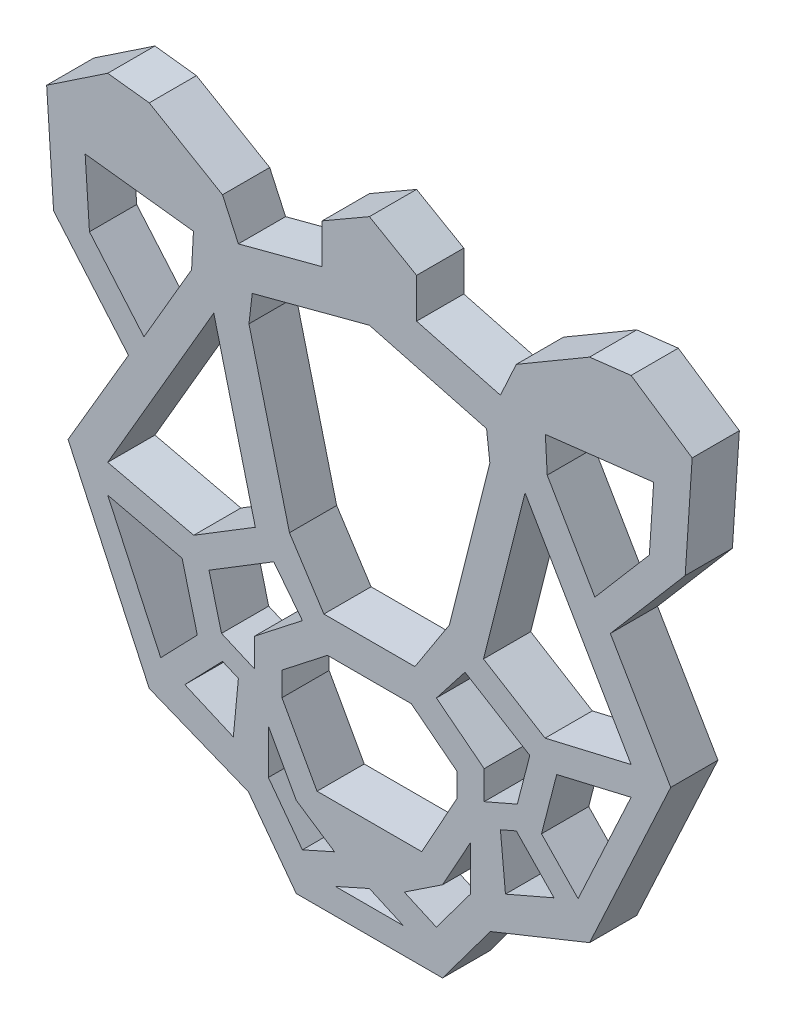
from build123d import *

# Parameters (mm, degrees)
BOSS_EXTRUDE1_DEPTH = 10
BOSS_EXTRUDE2_DEPTH = 10


with BuildPart() as part:
    # Sketch1 → Boss-Extrude1 (new body)
    with BuildSketch(Plane.XY):
        Polygon((127.703033666, 180.965914282), (99.942912825, 173.631948997), (96.578915919, 180.965914282), (81.052776354, 190.063780037), (72.254630601, 191.098856008), (59.316180963, 182.430094751), (60.790297203, 160.111634548), (76.653703478, 141.544593896), (63.855106266, 119.702899162), (81.052776354, 82.611392369), (102.070810081, 74.154129577), (112.205480651, 60.552230042), (143.200586682, 60.552230042), (153.335257251, 74.154129577), (174.353290979, 82.611392369), (191.550961067, 119.702899162), (178.752363855, 141.544593896), (194.61577013, 160.111634548), (196.089886369, 182.430094751), (183.151436732, 191.098856008), (174.353290979, 190.063780037), (158.827151414, 180.965914282), (155.463154508, 173.631948997), align=None)
        Polygon((67.474305777, 173.897244281), (68.387150649, 160.076562168), (79.931030202, 146.565234447), (90.026558446, 163.917673436), (90.423397797, 171.197351102), align=None, mode=Mode.SUBTRACT)
        Polygon((127.703033666, 172.577463554), (102.879615929, 166.019347867), (102.18046467, 160.076562168), (110.765700355, 126.038475421), (118.058737252, 114.76612201), (137.34733008, 114.76612201), (144.640366978, 126.038475421), (153.225602663, 160.076562168), (152.526451404, 166.019347867), align=None, mode=Mode.SUBTRACT)
        Polygon((136.586125745, 107.572158068), (118.819941588, 107.572158068), (109.172351708, 100.037547324), (109.172351708, 94.966141376), (116.6084589, 81.530126894), (138.797608433, 81.530126894), (146.233715625, 94.966141376), (146.233715625, 100.037547324), align=None, mode=Mode.SUBTRACT)
        Polygon((127.703033666, 69.222589269), (120.501208911, 66.003395505), (134.904858422, 66.003395505), align=None, mode=Mode.SUBTRACT)
        Polygon((106.298254857, 88.333075052), (112.205480651, 77.659537236), (120.314301927, 72.265301124), (113.507293972, 69.222589269), (106.298254857, 78.897953172), align=None, mode=Mode.SUBTRACT)
        Polygon((88.584904383, 87.077096627), (98.87165084, 82.611392369), (99.942912825, 93.893171548), (96.578915919, 95.353557042), align=None, mode=Mode.SUBTRACT)
        Polygon((88.013567695, 109.993210583), (91.237528294, 97.494221969), (83.484010106, 89.466752149), (72.254630601, 113.685998364), align=None, mode=Mode.SUBTRACT)
        Polygon((93.714725872, 110.641384033), (96.363799956, 100.371175761), (103.381612359, 97.324588109), (103.381612359, 103.375859749), (113.507293972, 111.283852358), (107.442428718, 119.04952661), align=None, mode=Mode.SUBTRACT)
        Polygon((72.254630601, 119.702899162), (94.729608094, 158.333436003), (103.533048595, 123.430227468), (90.476275499, 115.433025678), align=None, mode=Mode.SUBTRACT)
        Polygon((164.929791833, 115.433025678), (183.151436732, 119.702899162), (160.676459238, 158.333436003), (151.873018738, 123.430227468), align=None, mode=Mode.SUBTRACT)
        Polygon((147.963638615, 119.04952661), (161.691341461, 110.641384033), (159.042267377, 100.371175761), (152.024454974, 97.324588109), (152.024454974, 103.375859749), (141.898773361, 111.283852358), align=None, mode=Mode.SUBTRACT)
        Polygon((183.151436732, 113.685998364), (167.392499638, 109.993210583), (164.168539039, 97.494221969), (171.922057227, 89.466752149), align=None, mode=Mode.SUBTRACT)
        Polygon((158.827151414, 95.353557042), (166.821162949, 87.077096627), (156.534416493, 82.611392369), (155.463154508, 93.893171548), align=None, mode=Mode.SUBTRACT)
        Polygon((149.107812476, 78.897953172), (149.107812476, 88.333075052), (143.200586682, 77.659537236), (135.091765405, 72.265301124), (141.898773361, 69.222589269), align=None, mode=Mode.SUBTRACT)
        Polygon((164.982669535, 171.197351102), (187.931761556, 173.897244281), (187.018916684, 160.076562168), (175.475037131, 146.565234447), (165.379508887, 163.917673436), align=None, mode=Mode.SUBTRACT)
    extrude(amount=BOSS_EXTRUDE1_DEPTH)

    # Sketch2 → Boss-Extrude2 (add)
    with BuildSketch(Plane.XY.offset(10)):
        Polygon((137.703033666, 186.739416974), (127.703033666, 192.512919666), (117.703033666, 186.739416974), (117.703033666, 175.19241159), (123.949734855, 171.585876977), (127.703033666, 172.577463554), (131.456332478, 171.585876977), (137.703033666, 175.19241159), align=None)
    extrude(amount=-BOSS_EXTRUDE2_DEPTH)


solid = part.part
